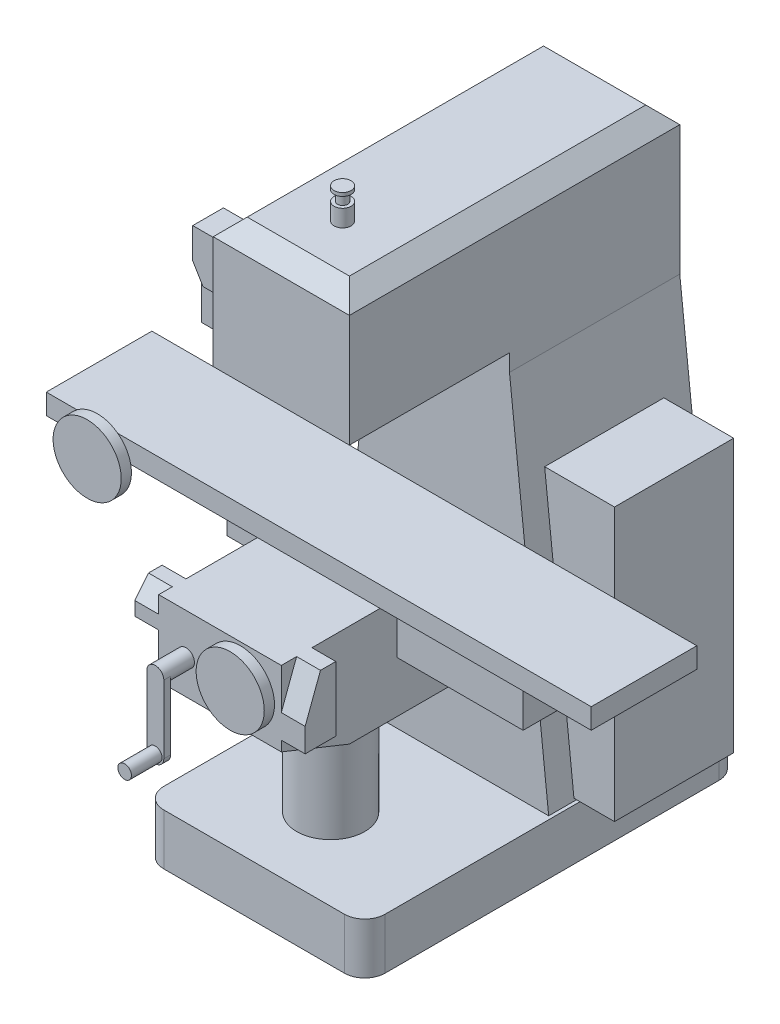
from build123d import *

# Parameters (mm, degrees)
SKETCH_2_W          = 400
SKETCH_2_H          = 430
EXTRUDE_2_DEPTH     = 970
EXTRUDE_3_DEPTH     = 500
SKETCH_4_W          = 650
SKETCH_4_H          = 1100
EXTRUDE_4_DEPTH     = 150
SKETCH_5_R          = 25
EXTRUDE_5_DEPTH     = 50
SKETCH_6_R          = 15
EXTRUDE_6_DEPTH     = 30
SKETCH_7_R          = 25
EXTRUDE_7_DEPTH     = 10
CHAMFER_1_SIZE      = 50
SKETCH_8_R          = 55
EXTRUDE_8_DEPTH     = 20
SKETCH_9_R          = 50
EXTRUDE_9_DEPTH     = 40
CHAMFER_2_SIZE      = 15
SKETCH_10_R         = 10
EXTRUDE_10_DEPTH    = 50
SKETCH_11_W         = 360
SKETCH_11_H         = 300
EXTRUDE_11_DEPTH    = 660
SKETCH_12_W         = 1600
SKETCH_12_H         = 310
EXTRUDE_12_DEPTH    = 60
SKETCH_13_W         = 350
SKETCH_13_H         = 800
EXTRUDE_13_DEPTH    = 570
SKETCH_14_R         = 100
EXTRUDE_14_DEPTH    = 400
EXTRUDE_15_DEPTH    = 100
CUT_EXTRUDE_1_DEPTH = 10
SKETCH_17_R         = 100
EXTRUDE_16_DEPTH    = 30
CUT_EXTRUDE_2_REACH = 2181.284
SKETCH_19_W         = 370
SKETCH_19_H         = 210
EXTRUDE_17_DEPTH    = 150
SKETCH_20_W         = 150
SKETCH_20_H         = 200
EXTRUDE_18_DEPTH    = 100
SKETCH_21_R         = 25
EXTRUDE_19_DEPTH    = 70
SKETCH_22_R         = 100
EXTRUDE_20_DEPTH    = 30
EXTRUDE_21_DEPTH    = 20
SKETCH_24_R         = 20
EXTRUDE_22_DEPTH    = 90
SKETCH_25_W         = 80
SKETCH_25_H         = 90
EXTRUDE_23_DEPTH    = 70
CUT_EXTRUDE_3_DEPTH = 70
SKETCH_27_W         = 90
SKETCH_27_H         = 190
EXTRUDE_24_DEPTH    = 70
CUT_EXTRUDE_4_DEPTH = 70
FILLET_1_R          = 60
SKETCH_29_W         = 50
SKETCH_29_H         = 50
EXTRUDE_25_DEPTH    = 200
SKETCH_30_W         = 50
SKETCH_30_H         = 50
EXTRUDE_26_DEPTH    = 150
SKETCH_31_W         = 260
SKETCH_31_H         = 160
EXTRUDE_27_DEPTH    = 80


with BuildPart() as part:
    # ｽｹｯﾁ2 → ﾎﾞｽ - 押し出し2 (new body)
    with BuildSketch(Plane.XY):
        with Locations((136.676642933, -128.098797217)):
            Rectangle(SKETCH_2_W, SKETCH_2_H)
    extrude(amount=EXTRUDE_2_DEPTH)

    # ｽｹｯﾁ3 → ﾎﾞｽ - 押し出し3 (add)
    with BuildSketch(Plane(origin=(0, 0, 0), x_dir=(-1, 0, 0), z_dir=(0, 0, -1))):
        Polygon((-451.676642933, -1413.098797217), (178.323357067, -1413.098797217), (63.323357067, -343.098797217), (-336.676642933, -343.098797217), align=None)
    extrude(amount=-EXTRUDE_3_DEPTH)

    # ｽｹｯﾁ4 → ﾎﾞｽ - 押し出し4 (add)
    with BuildSketch(Plane(origin=(0, -1413.098797217, 0), x_dir=(-1, 0, 0), z_dir=(0, -1, 0))):
        with Locations((-136.676642933, -500)):
            Rectangle(SKETCH_4_W, SKETCH_4_H)
    extrude(amount=EXTRUDE_4_DEPTH)

    # ｽｹｯﾁ5 → ﾎﾞｽ - 押し出し5 (add)
    with BuildSketch(Plane(origin=(0, 86.901202783, 0), x_dir=(1, 0, 0), z_dir=(0, 1, 0))):
        with Locations(Location((136.676642933, -790, 0), (0, 0, 90))):
            Circle(SKETCH_5_R)
    extrude(amount=EXTRUDE_5_DEPTH)

    # ｽｹｯﾁ6 → ﾎﾞｽ - 押し出し6 (add)
    with BuildSketch(Plane(origin=(0, 136.901202783, 0), x_dir=(1, 0, 0), z_dir=(0, 1, 0))):
        with Locations(Location((136.676642933, -790, 0), (0, 0, 270))):
            Circle(SKETCH_6_R)
    extrude(amount=EXTRUDE_6_DEPTH)

    # ｽｹｯﾁ7 → ﾎﾞｽ - 押し出し7 (add)
    with BuildSketch(Plane(origin=(0, 166.901202783, 0), x_dir=(1, 0, 0), z_dir=(0, 1, 0))):
        with Locations(Location((136.676642933, -790, 0), (0, 0, 90))):
            Circle(SKETCH_7_R)
    extrude(amount=EXTRUDE_7_DEPTH)

    # 面取り1
    chamfer_1_edges = [part.edges().sort_by_distance(p)[0] for p in [
        (-63.323357067, 86.901202783, 485),
        (136.676642933, 86.901202783, 0),
        (136.676642933, 86.901202783, 970),
        (336.676642933, 86.901202783, 485),
        (-63.323357067, -343.098797217, 735),
        (336.676642933, -343.098797217, 735),
        (136.676642933, -343.098797217, 970),
    ]]
    chamfer(chamfer_1_edges, length=CHAMFER_1_SIZE)

    # ｽｹｯﾁ8 → ﾎﾞｽ - 押し出し8 (add)
    with BuildSketch(Plane(origin=(0, -343.098797217, 0), x_dir=(-1, 0, 0), z_dir=(0, -1, 0))):
        with Locations(Location((-136.676642933, -790, 0), (0, 0, 270))):
            Circle(SKETCH_8_R)
    extrude(amount=EXTRUDE_8_DEPTH)

    # ｽｹｯﾁ9 → ﾎﾞｽ - 押し出し9 (add)
    with BuildSketch(Plane(origin=(0, -363.098797217, 0), x_dir=(-1, 0, 0), z_dir=(0, -1, 0))):
        with Locations(Location((-136.676642933, -790, 0), (0, 0, 90))):
            Circle(SKETCH_9_R)
    extrude(amount=EXTRUDE_9_DEPTH)

    # 面取り2
    chamfer_2_edges = [part.edges().sort_by_distance(p)[0] for p in [
        (136.676642933, -403.098797217, 840),
    ]]
    chamfer(chamfer_2_edges, length=CHAMFER_2_SIZE)

    # ｽｹｯﾁ10 → ﾎﾞｽ - 押し出し10 (add)
    with BuildSketch(Plane(origin=(0, -403.098797217, 0), x_dir=(-1, 0, 0), z_dir=(0, -1, 0))):
        with Locations(Location((-136.676642933, -790, 0), (0, 0, 90))):
            Circle(SKETCH_10_R)
    extrude(amount=EXTRUDE_10_DEPTH)

    # ｽｹｯﾁ11 → ﾎﾞｽ - 押し出し11 (add)
    with BuildSketch(Plane.XY.offset(500)):
        with Locations((146.676642933, -913.098797217)):
            Rectangle(SKETCH_11_W, SKETCH_11_H)
    extrude(amount=EXTRUDE_11_DEPTH)

    # ｽｹｯﾁ12 → ﾎﾞｽ - 押し出し12 (add)
    with BuildSketch(Plane(origin=(0, -763.098797217, 0), x_dir=(1, 0, 0), z_dir=(0, 1, 0))):
        with Locations((146.676642933, -715)):
            Rectangle(SKETCH_12_W, SKETCH_12_H)
    extrude(amount=EXTRUDE_12_DEPTH)

    # ｽｹｯﾁ13 → ﾎﾞｽ - 押し出し13 (add)
    with BuildSketch(Plane(origin=(0, 0, 0), x_dir=(0, 0, -1), z_dir=(1, 0, 0))):
        with Locations((-250, -1006.142275478)):
            Rectangle(SKETCH_13_W, SKETCH_13_H)
    extrude(amount=EXTRUDE_13_DEPTH)

    # ｽｹｯﾁ14 → ﾎﾞｽ - 押し出し14 (add)
    with BuildSketch(Plane(origin=(0, -1413.098797217, 0), x_dir=(1, 0, 0), z_dir=(0, 1, 0))):
        with Locations(Location((121.676642933, -810, 0), (0, 0, 90))):
            Circle(SKETCH_14_R)
    extrude(amount=EXTRUDE_14_DEPTH)

    # ｽｹｯﾁ15 → ﾎﾞｽ - 押し出し15 (add)
    with BuildSketch(Plane.XY.offset(970)):
        Polygon((-63.323357067, 25.333856753), (-133.323357067, 25.333856753), (-133.323357067, -64.666143247), (-103.323357067, -114.666143247), (-63.323357067, -114.666143247), align=None)
    extrude(amount=-EXTRUDE_15_DEPTH)

    # ｽｹｯﾁ16 → ｶｯﾄ - 押し出し1 (cut)
    with BuildSketch(Plane.XY.offset(970)):
        Polygon((-63.323357067, 25.333856753), (-133.323357067, 25.333856753), (-133.323357067, -64.666143247), (-103.323357067, -114.666143247), (-63.323357067, -114.666143247), align=None)
    extrude(amount=-CUT_EXTRUDE_1_DEPTH, mode=Mode.SUBTRACT)

    # ｽｹｯﾁ17 → ﾎﾞｽ - 押し出し16 (add)
    with BuildSketch(Plane.XY.offset(870)):
        with Locations(Location((-503.323357067, -783.098797217, 0), (0, 0, 168.463040967))):
            Circle(SKETCH_17_R)
    extrude(amount=EXTRUDE_16_DEPTH)

    # ｽｹｯﾁ18 → ｶｯﾄ - 押し出し2 (cut, up to next)
    with BuildSketch(Plane.ZY.offset(33.323357067), mode=Mode.PRIVATE) as cut_extrude_2_sk1:
        Polygon((1160, -1063.098797217), (1160, -983.098797217), (960, -1063.098797217), align=None)
    cut_extrude_2_tool1 = extrude(cut_extrude_2_sk1.sketch, amount=-CUT_EXTRUDE_2_REACH, mode=Mode.PRIVATE) & part.part
    add(cut_extrude_2_tool1.solids().sort_by_distance((-33.323357, -1036.432131, 1093.333333))[0], mode=Mode.SUBTRACT)

    # ｽｹｯﾁ19 → ﾎﾞｽ - 押し出し17 (add)
    with BuildSketch(Plane(origin=(0, -763.098797217, 0), x_dir=(-1, 0, 0), z_dir=(0, -1, 0))):
        with Locations((-511.676642933, -715)):
            Rectangle(SKETCH_19_W, SKETCH_19_H)
    extrude(amount=EXTRUDE_17_DEPTH)

    # ｽｹｯﾁ20 → ﾎﾞｽ - 押し出し18 (add)
    with BuildSketch(Plane(origin=(0, -763.098797217, 0), x_dir=(-1, 0, 0), z_dir=(0, -1, 0))):
        with Locations((108.323357067, -710)):
            Rectangle(SKETCH_20_W, SKETCH_20_H)
    extrude(amount=EXTRUDE_18_DEPTH)

    # ｽｹｯﾁ21 → ﾎﾞｽ - 押し出し19 (add)
    with BuildSketch(Plane.XY.offset(1160)):
        with Locations((46.676642933, -883.098797217)):
            Circle(SKETCH_21_R)
    extrude(amount=EXTRUDE_19_DEPTH)

    # ｽｹｯﾁ22 → ﾎﾞｽ - 押し出し20 (add)
    with BuildSketch(Plane.XY.offset(1160)):
        with Locations((206.676642933, -873.098797217)):
            Circle(SKETCH_22_R)
    extrude(amount=EXTRUDE_20_DEPTH)

    # ｽｹｯﾁ23 → ﾎﾞｽ - 押し出し21 (add)
    with BuildSketch(Plane.XY.offset(1230)):
        with BuildLine():
            Line((21.676642933, -883.098797217), (21.676642933, -1083.098797217))
            ThreePointArc((21.676642933, -1083.098797217), (46.676642933, -1108.098797217), (71.676642933, -1083.098797217))
            Line((71.676642933, -1083.098797217), (71.676642933, -883.098797217))
            ThreePointArc((71.676642933, -883.098797217), (46.676642933, -858.098797217), (21.676642933, -883.098797217))
        make_face()
    extrude(amount=EXTRUDE_21_DEPTH)

    # ｽｹｯﾁ24 → ﾎﾞｽ - 押し出し22 (add)
    with BuildSketch(Plane.XY.offset(1250)):
        with Locations(Location((46.676642933, -1083.098797217, 0), (0, 0, 180))):
            Circle(SKETCH_24_R)
    extrude(amount=EXTRUDE_22_DEPTH)

    # ｽｹｯﾁ25 → ﾎﾞｽ - 押し出し23 (add)
    with BuildSketch(Plane.ZY.offset(33.323357067)):
        with Locations((1120, -808.098797217)):
            Rectangle(SKETCH_25_W, SKETCH_25_H)
    extrude(amount=EXTRUDE_23_DEPTH)

    # ｽｹｯﾁ26 → ｶｯﾄ - 押し出し3 (cut)
    with BuildSketch(Plane.ZY.offset(103.323357067)):
        Polygon((1160, -763.098797217), (1120, -763.098797217), (1160, -813.098797217), align=None)
    extrude(amount=-CUT_EXTRUDE_3_DEPTH, mode=Mode.SUBTRACT)

    # ｽｹｯﾁ27 → ﾎﾞｽ - 押し出し24 (add)
    with BuildSketch(Plane(origin=(326.676642933, 0, 0), x_dir=(0, 0, -1), z_dir=(1, 0, 0))):
        with Locations((-1115, -858.098797217)):
            Rectangle(SKETCH_27_W, SKETCH_27_H)
    extrude(amount=EXTRUDE_24_DEPTH)

    # ｽｹｯﾁ28 → ｶｯﾄ - 押し出し4 (cut)
    with BuildSketch(Plane(origin=(396.676642933, 0, 0), x_dir=(0, 0, -1), z_dir=(1, 0, 0))):
        Polygon((-1115, -763.098797217), (-1160, -883.098797217), (-1160, -763.098797217), align=None)
    extrude(amount=-CUT_EXTRUDE_4_DEPTH, mode=Mode.SUBTRACT)

    # ﾌｨﾚｯﾄ1
    fillet_1_edges = [part.edges().sort_by_distance(p)[0] for p in [
        (461.676642933, -1488.098797217, -50),
        (461.676642933, -1488.098797217, 1050),
        (-188.323357067, -1488.098797217, 1050),
        (-188.323357067, -1488.098797217, -50),
    ]]
    fillet(fillet_1_edges, radius=FILLET_1_R)

    # ｽｹｯﾁ29 → ﾎﾞｽ - 押し出し25 (add)
    with BuildSketch(Plane.ZY.offset(63.323357067)):
        with Locations((445, -388.098797217)):
            Rectangle(SKETCH_29_W, SKETCH_29_H)
    extrude(amount=EXTRUDE_25_DEPTH)

    # ｽｹｯﾁ30 → ﾎﾞｽ - 押し出し26 (add)
    with BuildSketch(Plane.XY.offset(470)):
        with Locations((-238.323357067, -388.098797217)):
            Rectangle(SKETCH_30_W, SKETCH_30_H)
    extrude(amount=EXTRUDE_26_DEPTH)

    # ｽｹｯﾁ31 → ﾎﾞｽ - 押し出し27 (add)
    with BuildSketch(Plane.XY.offset(620)):
        with Locations((-238.323357067, -388.098797217)):
            Rectangle(SKETCH_31_W, SKETCH_31_H)
    extrude(amount=EXTRUDE_27_DEPTH)


solid = part.part
